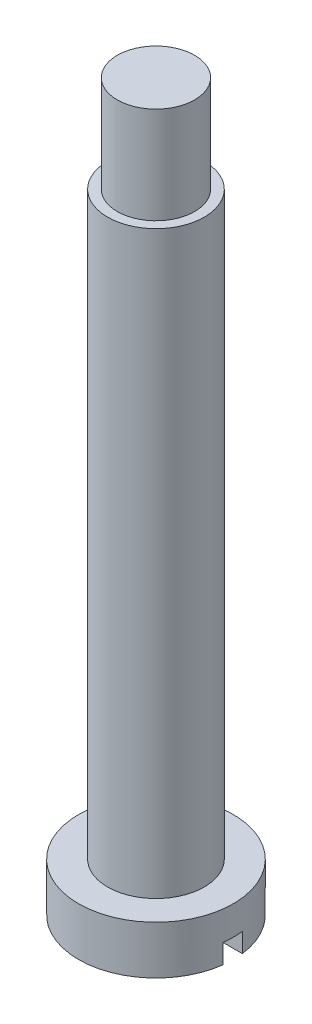
from build123d import *

# Parameters (mm, degrees)
SKETCH_1_R               = 4
EXTRUDE_1_DEPTH          = 2.5
SKETCH_2_R               = 2.5
EXTRUDE_2_DEPTH          = 30
SKETCH_3_R               = 2
EXTRUDE_3_DEPTH          = 5
CUT_EXTRUDE_1_DEPTH      = 38.924266638
CUT_EXTRUDE_1_DEPTH_BACK = 1
SKETCH_4_W               = 8
SKETCH_4_H               = 1


with BuildPart() as part:
    # 草图1 → 凸台-拉伸1 (new body)
    with BuildSketch(Plane(origin=(0, 0, 0), x_dir=(1, 0, 0), z_dir=(0, 1, 0))):
        Circle(SKETCH_1_R)
    extrude(amount=-EXTRUDE_1_DEPTH)

    # 草图2 → 凸台-拉伸2 (add)
    with BuildSketch(Plane(origin=(0, 0, 0), x_dir=(1, 0, 0), z_dir=(0, 1, 0))):
        Circle(SKETCH_2_R)
    extrude(amount=EXTRUDE_2_DEPTH)

    # 草图3 → 凸台-拉伸3 (add)
    with BuildSketch(Plane(origin=(0, 30, 0), x_dir=(1, 0, 0), z_dir=(0, 1, 0))):
        Circle(SKETCH_3_R)
    extrude(amount=EXTRUDE_3_DEPTH)

    # 草图4 → 切除-拉伸-薄壁1 (cut, two sides: drawn at the far end of the back side and taken through both)
    with BuildSketch(Plane.XZ.offset(2.5).offset(-CUT_EXTRUDE_1_DEPTH_BACK)):
        Rectangle(SKETCH_4_W, SKETCH_4_H)
    extrude(amount=CUT_EXTRUDE_1_DEPTH + CUT_EXTRUDE_1_DEPTH_BACK, mode=Mode.SUBTRACT)


solid = part.part
